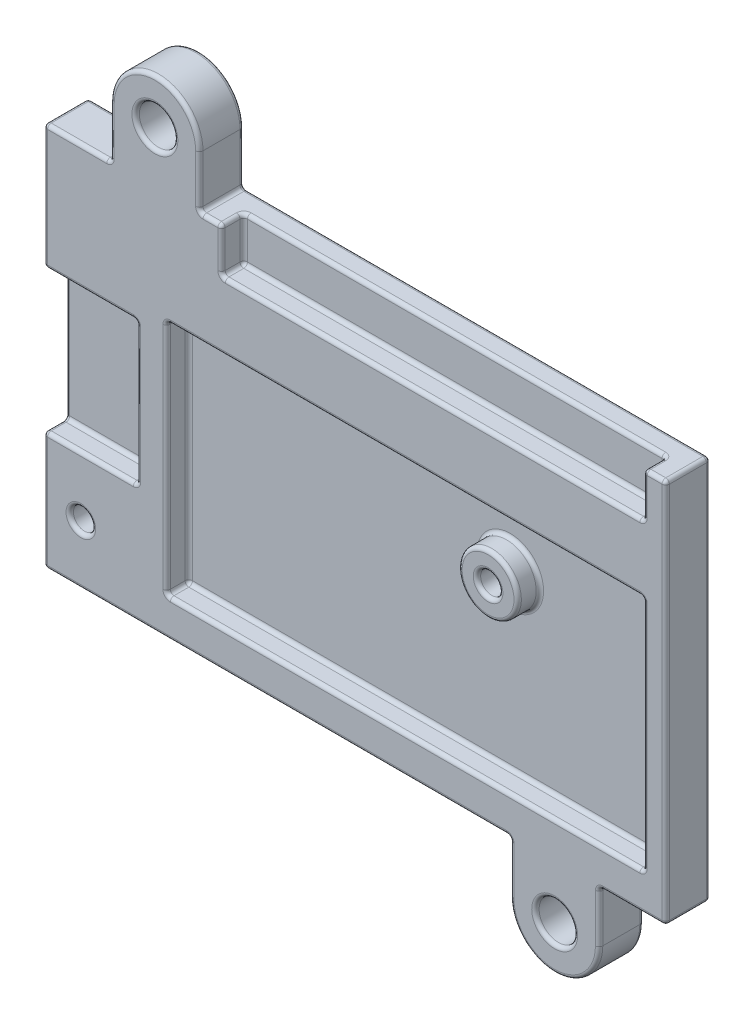
from build123d import *

# Parameters (mm, degrees)
SKETCH1_W               = 52
SKETCH1_H               = 84
SKETCH1_R               = 2.25
BASE_DEPTH              = 3
SKETCH2_R               = 4
SKETCH2_R_2             = 1.5
SKETCH2_W               = 12.58
SKETCH2_H               = 16
POSTS_DEPTH             = 3
SKETCH3_W               = 64.42
SKETCH3_H               = 32
SUPPORTS_DEPTH          = 3
MOUNTINGLUGS_DEPTH      = 3
MOUNTINGLUGS_DEPTH_BACK = 3
SKETCH5_R               = 2.6
FILLET2_R               = 0.5


with BuildPart() as part:
    # Sketch1 → Base (new body)
    with BuildSketch(Plane(origin=(0, 0, 0), x_dir=(0, 1, 0), z_dir=(0, 0, 1))):
        with Locations((-2, 18)):
            Rectangle(SKETCH1_W, SKETCH1_H)
        with Locations(Location((0, 0, 0), (0, 0, 270))):
            Circle(SKETCH1_R, mode=Mode.SUBTRACT)
        with Locations(Location((-20, 55, 0), (0, 0, 270))):
            Circle(SKETCH1_R, mode=Mode.SUBTRACT)
    extrude(amount=BASE_DEPTH)

    # Sketch2 → Posts (add)
    # profile 1 of 2: a face of its own
    with BuildSketch(Plane.XY.offset(3)):
        Circle(SKETCH2_R)
        Circle(SKETCH2_R_2, mode=Mode.SUBTRACT)
    # profile 2 of 2: a face of its own
    with BuildSketch(Plane.XY.offset(3)):
        with Locations((-53.71, -20)):
            Rectangle(SKETCH2_W, SKETCH2_H)
        with Locations((-55, -20)):
            Circle(SKETCH2_R_2, mode=Mode.SUBTRACT)
    extrude(amount=POSTS_DEPTH)

    # Sketch3 → Supports (add)
    with BuildSketch(Plane.XY.offset(3)):
        Polygon((24, 24), (21, 24), (21, 18), (-36, 18), (-36, 24), (-47.42, 24), (-60, 24), (-60, 7.15), (-47.42, 7.15), (-47.42, -28), (-43.42, -28), (21, -28), (24, -28), align=None)
        with Locations((-11.21, -7)):
            Rectangle(SKETCH3_W, SKETCH3_H, mode=Mode.SUBTRACT)
    extrude(amount=SUPPORTS_DEPTH)

    # Sketch5 → MountingLugs (add, two sides: drawn at the far end of the back side and taken through both)
    # profile 1 of 2: a face of its own
    with BuildSketch(Plane.XY.offset(3).offset(-MOUNTINGLUGS_DEPTH_BACK)):
        with BuildLine():
            Line((-51, 31), (-51, 24))
            Line((-51, 24), (-39, 24))
            Line((-39, 24), (-39, 31))
            ThreePointArc((-39, 31), (-45, 37), (-51, 31))
        make_face()
        with Locations((-45, 31)):
            Circle(SKETCH5_R, mode=Mode.SUBTRACT)
    # profile 2 of 2: a face of its own
    with BuildSketch(Plane.XY.offset(3).offset(-MOUNTINGLUGS_DEPTH_BACK)):
        with BuildLine():
            Line((3, -35), (3, -28))
            Line((3, -28), (15, -28))
            Line((15, -28), (15, -35))
            ThreePointArc((15, -35), (9, -41), (3, -35))
        make_face()
        with Locations((9, -35)):
            Circle(SKETCH5_R, mode=Mode.SUBTRACT)
    extrude(amount=MOUNTINGLUGS_DEPTH + MOUNTINGLUGS_DEPTH_BACK)

    # Fillet2
    fillet2_edges = [part.edges().sort_by_distance(p)[0] for p in [
        (-45, 37, 6),
        (-51, 27.5, 6),
        (-39, 27.5, 6),
        (9, -41, 0),
        (3, -31.5, 0),
        (3, -28, 3),
        (15, -28, 3),
        (15, -31.5, 0),
        (6.4, -35, 0),
        (6.4, -35, 6),
        (9, -41, 6),
        (15, -31.5, 6),
        (3, -31.5, 6),
        (-2.25, 0, 0),
        (-57.25, -20, 0),
        (-4, 0, 3),
        (-60, -20, 6),
        (-28.5, -28, 6),
        (-53.71, -12, 6),
        (-60, -12, 4.5),
        (-53.71, -12, 3),
        (-47.42, -12, 4.5),
        (-56.5, -20, 6),
        (-4, 0, 6),
        (-1.5, 0, 6),
        (-60, -2.425, 3),
        (-7.5, 24, 3),
        (24, -2, 0),
        (24, -2, 6),
        (22.5, 24, 6),
        (21, 21, 6),
        (-7.5, 18, 6),
        (-36, 21, 6),
        (-37.5, 24, 6),
        (-28.5, -28, 0),
        (-60, 15.575, 6),
        (-53.71, 7.15, 6),
        (-47.42, -2.425, 6),
        (-43.42, -7, 3),
        (-11.21, -23, 3),
        (21, -7, 3),
        (-11.21, 9, 3),
        (-60, -2, 0),
        (21, 21, 3),
        (21, 24, 4.5),
        (-7.5, 18, 3),
        (21, 18, 4.5),
        (-36, 21, 3),
        (-36, 18, 4.5),
        (-36, 24, 4.5),
        (-53.71, 7.15, 3),
        (-60, 7.15, 4.5),
        (-47.42, 7.15, 4.5),
        (-47.42, -2.425, 3),
        (-11.21, -23, 6),
        (-7.5, 24, 0),
        (21, -23, 4.5),
        (21, -7, 6),
        (21, 9, 4.5),
        (-11.21, 9, 6),
        (-43.42, 9, 4.5),
        (-43.42, -7, 6),
        (-43.42, -23, 4.5),
        (24, 24, 3),
        (24, -28, 3),
        (-60, -28, 3),
        (-60, 24, 3),
        (19.5, -28, 6),
        (19.5, -28, 0),
        (-55.5, 24, 0),
        (-55.5, 24, 6),
        (-45, 37, 0),
        (-39, 27.5, 0),
        (-39, 24, 3),
        (-51, 24, 3),
        (-51, 27.5, 0),
        (-47.6, 31, 0),
        (-47.6, 31, 6),
    ]]
    fillet(fillet2_edges, radius=FILLET2_R)


solid = part.part
